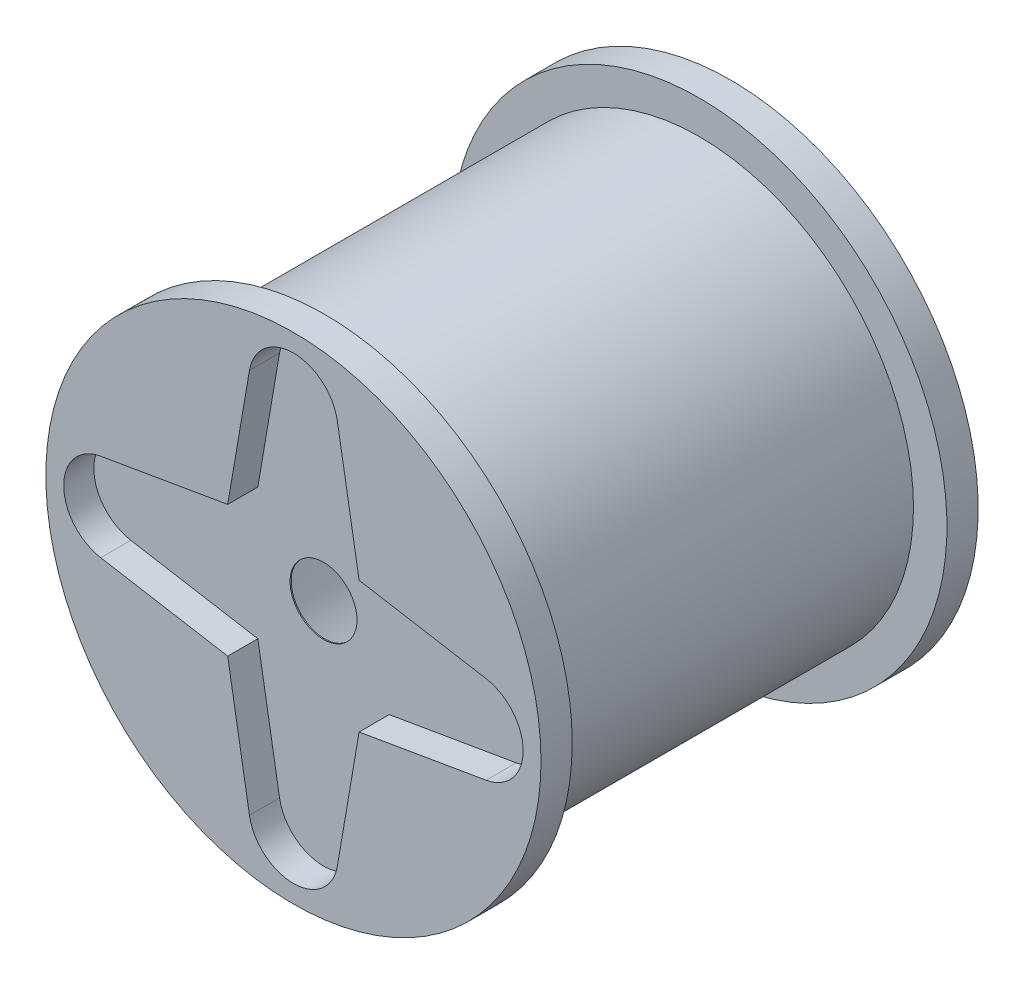
from build123d import *

# Parameters (mm, degrees)
AUFSATZ_LINEAR_AUSTRAGEN1_DEPTH      = 9.8
AUFSATZ_LINEAR_AUSTRAGEN1_DEPTH_BACK = 9.8
SKIZZE1_R                            = 9.6
SKIZZE2_R                            = 11.1
AUFSATZ_LINEAR_AUSTRAGEN2_DEPTH      = 1.4
AUFSATZ_LINEAR_START                 = -1.4
SKIZZE3_R                            = 11.1
AUFSATZ_LINEAR_AUSTRAGEN3_DEPTH      = 1.4
SCHNITT_LINEAR_AUSTRAGEN1_DEPTH      = 1.35
KREISMUSTER1_COUNT                   = 4
SKIZZE9_R                            = 1.5
SCHNITT_LINEAR_AUSTRAGEN2_DEPTH      = 1.2


with BuildPart() as part:
    # Skizze1 → Aufsatz-Linear austragen1 (new, two sides: drawn at the far end of the back side and taken through both)
    with BuildSketch(Plane.XY.offset(-AUFSATZ_LINEAR_AUSTRAGEN1_DEPTH_BACK)):
        Circle(SKIZZE1_R)
    extrude(amount=AUFSATZ_LINEAR_AUSTRAGEN1_DEPTH + AUFSATZ_LINEAR_AUSTRAGEN1_DEPTH_BACK)

    # Skizze2 → Aufsatz-Linear austragen2 (add)
    with BuildSketch(Plane.XY.offset(9.8)):
        Circle(SKIZZE2_R)
    extrude(amount=-AUFSATZ_LINEAR_AUSTRAGEN2_DEPTH)

    # Skizze3 → Aufsatz-Linear austragen3 (add)
    with BuildSketch(Plane(origin=(0, 0, -9.8), x_dir=(-1, 0, 0), z_dir=(0, 0, -1)).offset(AUFSATZ_LINEAR_START)):
        Circle(SKIZZE3_R)
    extrude(amount=AUFSATZ_LINEAR_AUSTRAGEN3_DEPTH)

    # Skizze4 → Schnitt-Linear austragen1 (cut)
    with BuildSketch(Plane.XY.offset(9.8)):
        with BuildLine():
            Line((-1.971343548, 8.637349398), (-3.351284031, 0.573493976))
            ThreePointArc((-3.351284031, 0.573493976), (0, -3.4), (3.351284031, 0.573493976))
            Line((3.351284031, 0.573493976), (1.971343548, 8.637349398))
            ThreePointArc((1.971343548, 8.637349398), (0, 10.3), (-1.971343548, 8.637349398))
        make_face()
    schnitt_linear_austragen1 = extrude(amount=-SCHNITT_LINEAR_AUSTRAGEN1_DEPTH, mode=Mode.SUBTRACT)

    # Kreismuster1: Schnitt-Linear austragen1 ×4 about axis
    kreismuster1_axis = Axis((0, 0, -9.8), (0, 0, 1))
    for i in range(1, KREISMUSTER1_COUNT):
        add(schnitt_linear_austragen1.rotate(kreismuster1_axis, i * 360 / KREISMUSTER1_COUNT), mode=Mode.SUBTRACT)

    # Skizze8 → Schnitt-Rotation1 (revolve, cut)
    with BuildSketch(Plane(origin=(0, 0, 0), x_dir=(0, 0, -1), z_dir=(1, 0, 0))):
        Polygon((9.8, 0), (9.8, 8), (8.4, 8), (-8.4, 3.5), (-8.4, 0), align=None)
    revolve(axis=Axis((0, 0, -9.8), (0, 0, 1)), mode=Mode.SUBTRACT)

    # Skizze9 → Schnitt-Linear austragen2 (cut)
    with BuildSketch(Plane.XY.offset(8.45)):
        Circle(SKIZZE9_R)
    extrude(amount=-SCHNITT_LINEAR_AUSTRAGEN2_DEPTH, mode=Mode.SUBTRACT)


solid = part.part
